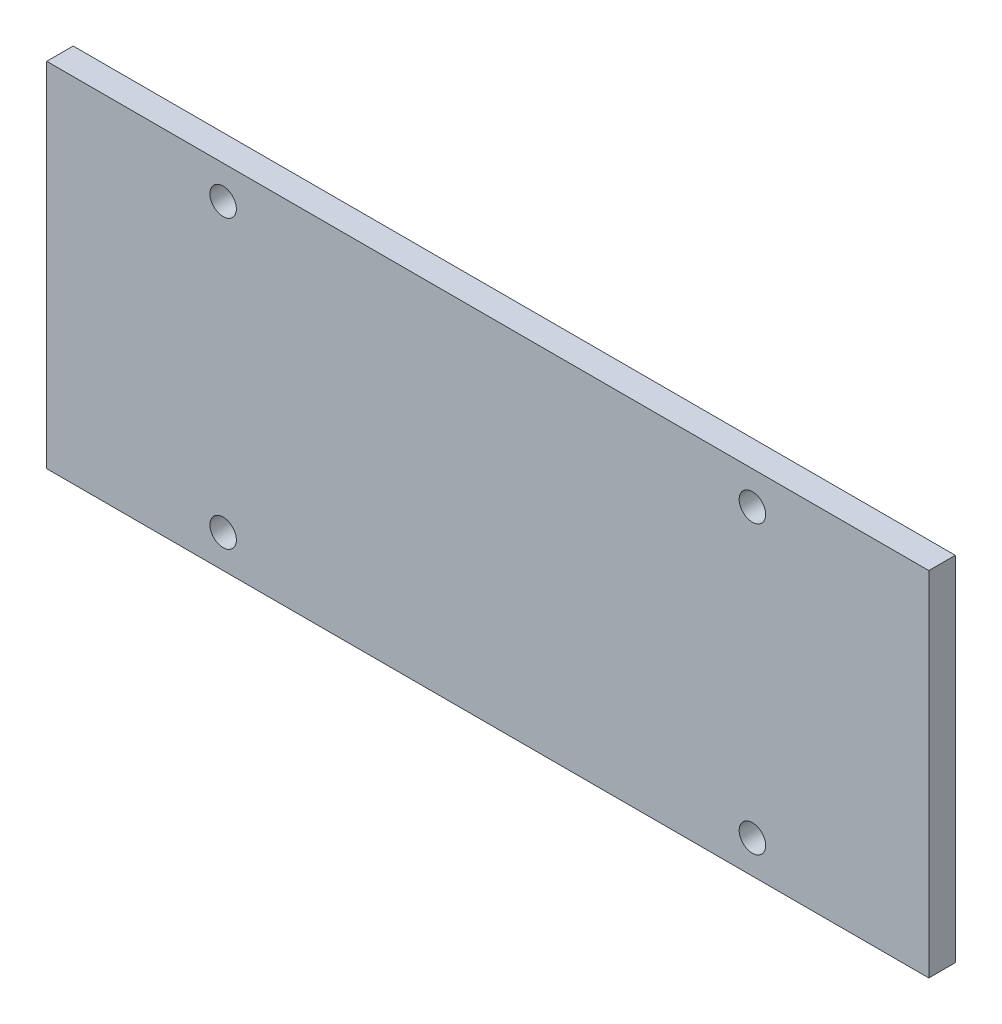
from build123d import *

# Parameters (mm, degrees)
SKETCH1_W           = 100
SKETCH1_H           = 40
SKETCH1_R           = 1.5
BOSS_EXTRUDE1_DEPTH = 3


with BuildPart() as part:
    # Sketch1 → Boss-Extrude1 (new body)
    with BuildSketch(Plane.XY):
        Rectangle(SKETCH1_W, SKETCH1_H)
        with Locations((-30, 16.25)):
            Circle(SKETCH1_R, mode=Mode.SUBTRACT)
        with Locations((30, 16.25)):
            Circle(SKETCH1_R, mode=Mode.SUBTRACT)
        with Locations((30, -16.25)):
            Circle(SKETCH1_R, mode=Mode.SUBTRACT)
        with Locations((-30, -16.25)):
            Circle(SKETCH1_R, mode=Mode.SUBTRACT)
    extrude(amount=BOSS_EXTRUDE1_DEPTH)


solid = part.part
